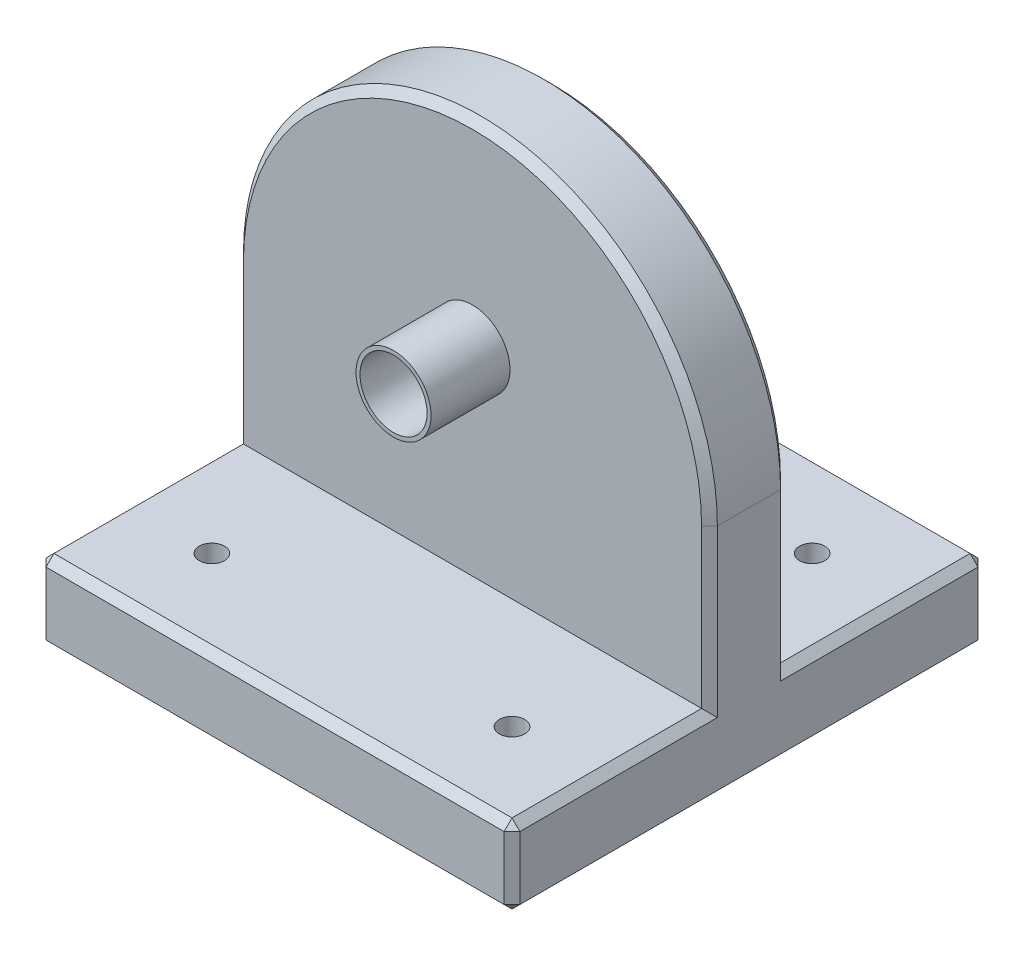
from build123d import *

# Parameters (mm, degrees)
SKETCH_1_W      = 60
SKETCH_1_H      = 50
EXTRUDE_1_DEPTH = 10
SKETCH_8_W      = 60
SKETCH_8_H      = 60
EXTRUDE_2_DEPTH = 10
SKETCH_9_R      = 4.75
SKETCH_9_R_2    = 4.25
EXTRUDE_3_DEPTH = 10
FILLET_1_RADIUS = 30
FILLET_1_LENGTH = 10
CHAMFER_1_SIZE  = 1
HOLE_WIZARD_4_D = 3.2


with BuildPart() as part:
    # 草图1 → 凸台-拉伸1 (new body)
    with BuildSketch(Plane.XY):
        Rectangle(SKETCH_1_W, SKETCH_1_H)
    extrude(amount=EXTRUDE_1_DEPTH)

    # 草图3 → 孔1 (revolve, cut)
    with BuildSketch(Plane(origin=(0, 0, 10), x_dir=(0, -1, 0), z_dir=(1, 0, 0))):
        Polygon((0, 0), (0, 10), (4, 10), (4, 0.603553391), (4.25, 0), align=None)
    revolve(axis=Axis((0, 0, 16.445314094), (0, 0, -1)), mode=Mode.SUBTRACT)

    # 草图8 → 凸台-拉伸2 (add)
    with BuildSketch(Plane.XZ.offset(25)):
        with Locations((0, 5)):
            Rectangle(SKETCH_8_W, SKETCH_8_H)
    extrude(amount=EXTRUDE_2_DEPTH)

    # 草图9 → 凸台-拉伸3 (add)
    with BuildSketch(Plane.XY.offset(10)):
        with Locations(Location((0, 0, 0), (0, 0, 180))):
            Circle(SKETCH_9_R)
        Circle(SKETCH_9_R_2, mode=Mode.SUBTRACT)
    extrude(amount=EXTRUDE_3_DEPTH)

    # 圆角1: full round fillet: the end face becomes a half cylinder, R = half its width
    fillet_1_face = Plane((0, 25, 5), x_dir=(0, 0, 1), z_dir=(0, 1, 0))  # on the end face: x along it, z out of the body
    fillet_1_slab = fillet_1_face.offset(-FILLET_1_RADIUS / 2) * Box(FILLET_1_LENGTH, 2 * FILLET_1_RADIUS, FILLET_1_RADIUS, mode=Mode.PRIVATE)  # the body's end, R deep
    fillet_1_round = Plane((0, -5, 5), x_dir=(0, 1, 0), z_dir=(0, 0, 1)) * Cylinder(FILLET_1_RADIUS, FILLET_1_LENGTH, mode=Mode.PRIVATE)  # its axis R under the face
    add(fillet_1_slab - fillet_1_round, mode=Mode.SUBTRACT)

    # 倒角1
    chamfer_1_edges = [part.edges().sort_by_distance(p)[0] for p in [
        (30, -25, -12.5),
        (30, -25, 22.5),
        (30, -30, -25),
        (0, -25, 35),
        (30, -30, 35),
        (-30, -25, 22.5),
        (-30, -25, -12.5),
        (-30, -30, 35),
        (0, -25, -25),
        (-30, -30, -25),
        (30, -35, 5),
        (0, -35, 35),
        (-30, -35, 5),
        (0, -35, -25),
        (-30, -15, 0),
        (-30, -15, 10),
        (0, 25, 10),
        (0, 25, 0),
        (30, -15, 10),
        (30, -15, 0),
    ]]
    chamfer(chamfer_1_edges, length=CHAMFER_1_SIZE)

    # 孔4 (through all)
    with Locations(Plane(origin=(0, -25, 0), x_dir=(1, 0, 0), z_dir=(0, 1, 0))):
        with Locations((-19, 14), (19, 14), (19, -24), (-19, -24)):
            Hole(HOLE_WIZARD_4_D / 2)


solid = part.part
